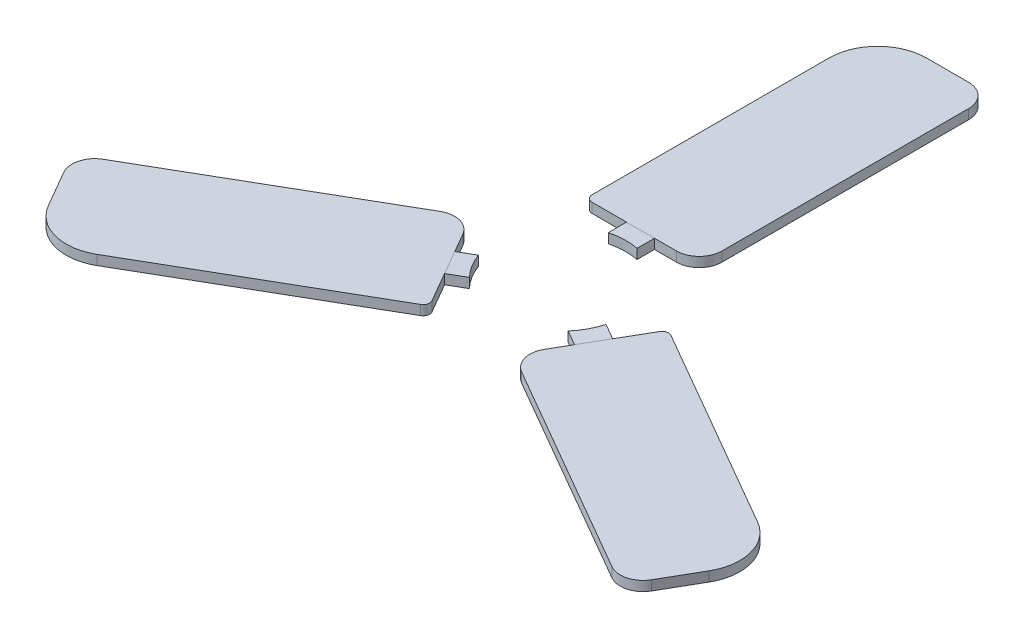
from build123d import *

# Parameters (mm, degrees)
BOSS_EXTRUDE1_DEPTH = 30
SKETCH2_R           = 150.200555771
BOSS_EXTRUDE2_DEPTH = 30
CIRPATTERN2_COUNT   = 3
BOSS_EXTRUDE4_DEPTH = 30
CIRPATTERN3_COUNT   = 3
SKETCH6_R           = 200
CUT_EXTRUDE1_DEPTH  = 30


with BuildPart() as part:
    # Sketch1 → Boss-Extrude1 (new body)
    with BuildSketch(Plane(origin=(0, 0, 0), x_dir=(1, 0, 0), z_dir=(0, 1, 0))):
        with BuildLine():
            Line((0, 0), (-105.994049605, 0))
            ThreePointArc((-105.994049605, 0), (-120.136185229, 5.857864376), (-125.994049605, 20))
            Line((-125.994049605, 20), (-125.994049605, 750))
            ThreePointArc((-125.994049605, 750), (-82.060066783, 856.066017178), (24.005950395, 900))
            Line((24.005950395, 900), (154.005950395, 900))
            ThreePointArc((154.005950395, 900), (203.503425078, 879.497474683), (224.005950395, 830))
            Line((224.005950395, 830), (224.005950395, 70))
            ThreePointArc((224.005950395, 70), (203.503425078, 20.502525317), (154.005950395, 0))
            Line((154.005950395, 0), (0, 0))
        make_face()
    extrude(amount=BOSS_EXTRUDE1_DEPTH)


with BuildPart() as body_2:
    # Sketch2 → Boss-Extrude2 (new body)
    with BuildSketch(Plane(origin=(0, 0, 0), x_dir=(1, 0, 0), z_dir=(0, 1, 0))):
        with Locations(Location((49.005950395, -250, 0), (0, 0, 270))):
            Circle(SKETCH2_R)
    extrude(amount=BOSS_EXTRUDE2_DEPTH)


with BuildPart() as cirpattern2_1:
    # CirPattern2: pattern copy
    add(part.part.rotate(Axis((49.005950395, 0, 250), (0, 1, 0)), 1 * 360 / CIRPATTERN2_COUNT))


with BuildPart() as cirpattern2_2:
    # CirPattern2: pattern copy
    add(part.part.rotate(Axis((49.005950395, 0, 250), (0, 1, 0)), 2 * 360 / CIRPATTERN2_COUNT))


with BuildPart() as body_5:
    # Sketch3 → Boss-Extrude4 (new body)
    with BuildSketch(Plane(origin=(0, 30, 0), x_dir=(1, 0, 0), z_dir=(0, 1, 0))):
        with BuildLine():
            Line((0, -108.018931615), (0, 0))
            Line((0, 0), (86.073824667, 0))
            Line((86.073824667, 0), (86.073824667, -104.445269225))
            ThreePointArc((86.073824667, -104.445269225), (42.775205568, -99.928734353), (0, -108.018931615))
        make_face()
    extrude(amount=-BOSS_EXTRUDE4_DEPTH)


with BuildPart() as cirpattern3_1:
    # CirPattern3: pattern copy
    add(body_5.part.rotate(Axis((49.005950395, 0, 250), (0, 1, 0)), 1 * 360 / CIRPATTERN3_COUNT))


with BuildPart() as cirpattern3_2:
    # CirPattern3: pattern copy
    add(body_5.part.rotate(Axis((49.005950395, 0, 250), (0, 1, 0)), 2 * 360 / CIRPATTERN3_COUNT))


with BuildPart() as cut_extrude1_tool:
    # Sketch6 → Cut-Extrude1 (new body)
    with BuildSketch(Plane(origin=(0, 30, 0), x_dir=(1, 0, 0), z_dir=(0, 1, 0))):
        with Locations((49.005950395, -250)):
            Circle(SKETCH6_R)
    extrude(amount=-CUT_EXTRUDE1_DEPTH)


with BuildPart() as body_2_1:
    add(body_2.part)

    # Cut-Extrude1: cut by cut_extrude1_tool
    add(cut_extrude1_tool.part, mode=Mode.SUBTRACT)


with BuildPart() as body_5_1:
    add(body_5.part)

    # Cut-Extrude1: cut by cut_extrude1_tool
    add(cut_extrude1_tool.part, mode=Mode.SUBTRACT)


with BuildPart() as cirpattern3_1_1:
    add(cirpattern3_1.part)

    # Cut-Extrude1: cut by cut_extrude1_tool
    add(cut_extrude1_tool.part, mode=Mode.SUBTRACT)


with BuildPart() as cirpattern3_2_1:
    add(cirpattern3_2.part)

    # Cut-Extrude1: cut by cut_extrude1_tool
    add(cut_extrude1_tool.part, mode=Mode.SUBTRACT)


solid = Compound([part.part, cirpattern2_1.part, cirpattern2_2.part, body_5_1.part, cirpattern3_1_1.part, cirpattern3_2_1.part])
